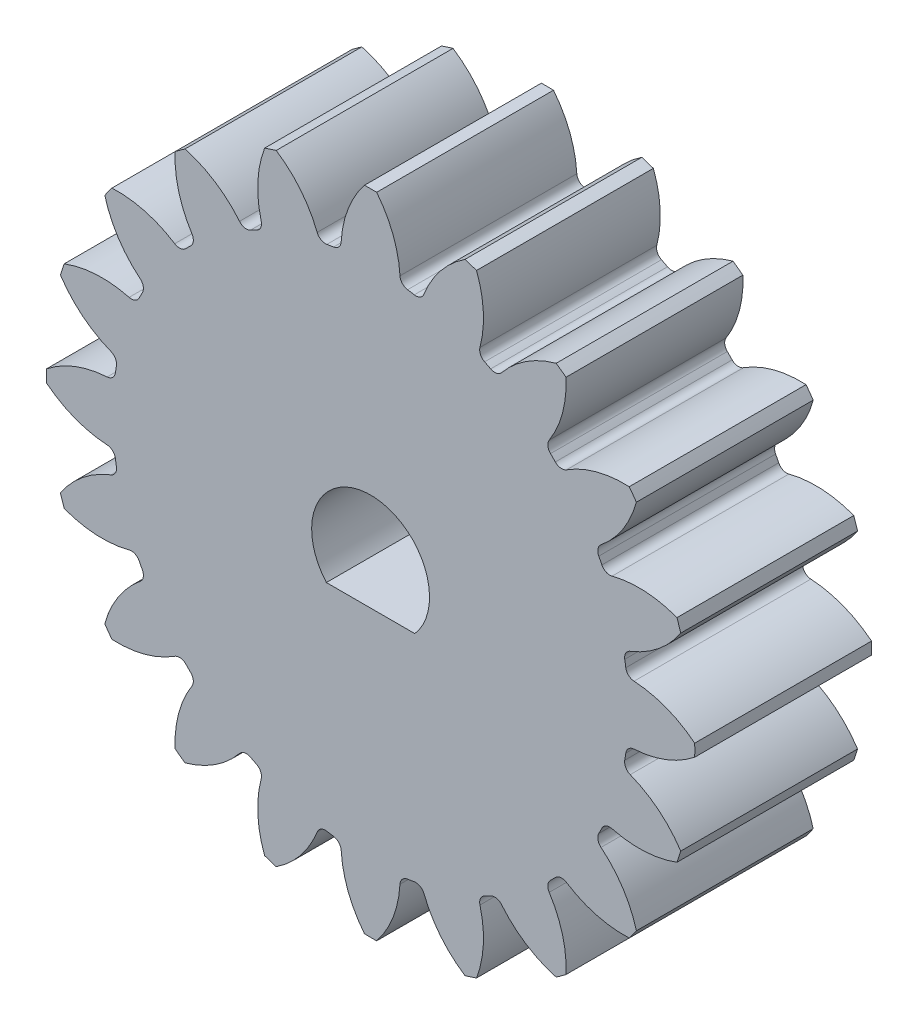
from build123d import *

# Parameters (mm, degrees)
CUT_EXTRUDE1_DEPTH  = 20.646882704
CIRPATTERN1_COUNT   = 20
SKETCH5_R           = 7.15
SKETCH5_R_2         = 2
BOSS_EXTRUDE1_DEPTH = 6
CUT_EXTRUDE2_REACH  = 18.673
SKETCH6_R           = 5.85
BOSS_EXTRUDE2_DEPTH = 3


with BuildPart() as part:
    # Sketch3 → Revolve1 (revolve)
    with BuildSketch(Plane(origin=(0, 0, 0), x_dir=(0, 0, -1), z_dir=(1, 0, 0)), mode=Mode.PRIVATE) as revolve1_sk:
        Polygon((-6, 11), (0, 11), (0, 7.15), (-1.714285714, 7.15), (-1.714285714, 5.85), (6, 5.85), (6, 2.5), (-6, 2.5), (-6, 5.85), (-4.285714286, 5.85), (-4.285714286, 7.15), (-6, 7.15), align=None)
    revolve(revolve1_sk.sketch.rotate(Axis((0, 0, -6), (0, 0, 1)), 90), axis=Axis((0, 0, -6), (0, 0, 1)))

    # Sketch4 → Cut-Extrude1 (cut, symmetric)
    with BuildSketch(Plane.XY.offset(6)):
        with BuildLine():
            ThreePointArc((-0.206650348, 10.998058721), (-0.762582532, 10.030093075), (-0.998187985, 8.938988976))
            ThreePointArc((-0.998187985, 8.938988976), (-1.076668536, 8.753613059), (-1.254660723, 8.65958004))
            ThreePointArc((-1.254660723, 8.65958004), (-1.368801569, 8.64227298), (-1.48270414, 8.623461511))
            ThreePointArc((-1.48270414, 8.623461511), (-1.681042571, 8.657889616), (-1.812966318, 8.809940765))
            ThreePointArc((-1.812966318, 8.809940765), (-2.374210129, 9.77483634), (-3.20205089, 10.523633883))
            ThreePointArc((-3.20205089, 10.523633883), (-1.720779115, 10.864571747), (-0.206650348, 10.998058721))
        make_face()
    cut_extrude1 = extrude(amount=CUT_EXTRUDE1_DEPTH, both=True, mode=Mode.SUBTRACT)

    # CirPattern1: Cut-Extrude1 ×20 about axis
    cirpattern1_axis = Axis((0, 0, 0), (0, 0, 1))
    for i in range(1, CIRPATTERN1_COUNT):
        add(cut_extrude1.rotate(cirpattern1_axis, i * 360 / CIRPATTERN1_COUNT), mode=Mode.SUBTRACT)

    # Sketch5 → Boss-Extrude1 (add)
    with BuildSketch(Plane.XY.offset(6)):
        Circle(SKETCH5_R)
        Circle(SKETCH5_R_2, mode=Mode.SUBTRACT)
    extrude(amount=-BOSS_EXTRUDE1_DEPTH)

    # Sketch6 → Cut-Extrude2 (cut, up to next)
    with BuildSketch(Plane(origin=(0, 0, 0), x_dir=(-1, 0, 0), z_dir=(0, 0, -1)), mode=Mode.PRIVATE) as cut_extrude2_sk1:
        Circle(SKETCH6_R)
    cut_extrude2_tool1 = extrude(cut_extrude2_sk1.sketch, amount=CUT_EXTRUDE2_REACH, mode=Mode.PRIVATE) & part.part
    add(cut_extrude2_tool1.solids().sort_by_distance((0, 0, 0))[0], mode=Mode.SUBTRACT)

    # 3DSketch1 → Boss-Extrude2 (add)
    with BuildSketch(Plane(origin=(-1.5, -1.322875656, 6), x_dir=(0.4472135954999579, 0, -0.894427190999916), z_dir=(0, -1, 0))):
        Polygon((0, 0), (1.341640786, 2.683281573), (6.708203932, 0), (5.366563146, -2.683281573), align=None)
    extrude(amount=BOSS_EXTRUDE2_DEPTH)


solid = part.part
